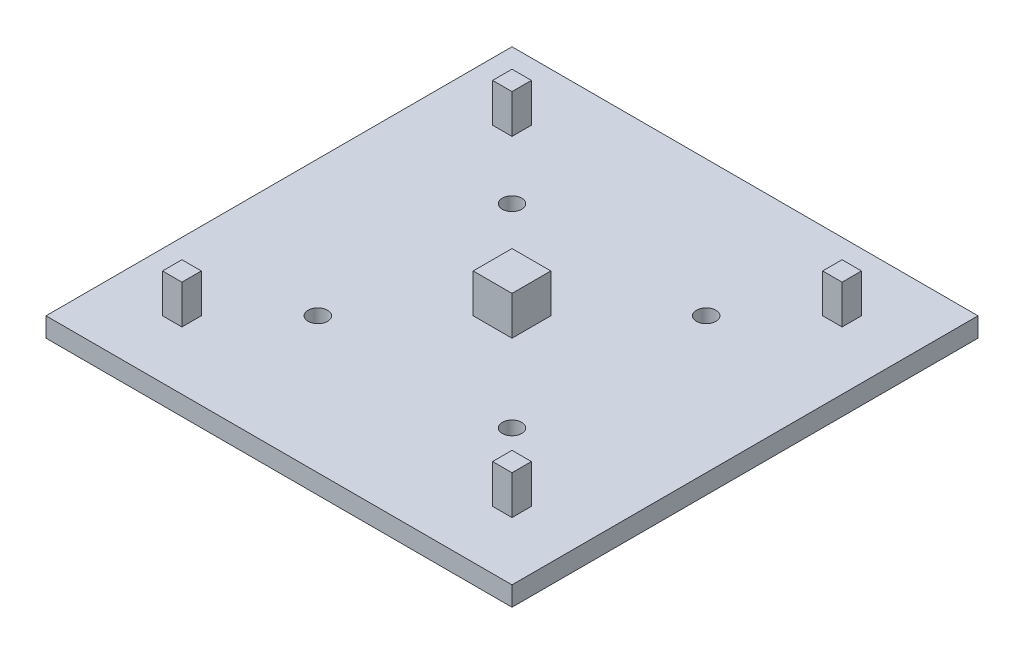
from build123d import *

# Parameters (mm, degrees)
SKETCH1_W           = 120
SKETCH1_H           = 120
BOSS_EXTRUDE1_DEPTH = 5
SKETCH2_R           = 2.5
CUT_EXTRUDE1_DEPTH  = 5
SKETCH3_R           = 2.5
CUT_EXTRUDE2_DEPTH  = 5
SKETCH4_R           = 2.5
CUT_EXTRUDE3_DEPTH  = 5
SKETCH5_R           = 2.5
CUT_EXTRUDE4_DEPTH  = 5
SKETCH6_W           = 10
SKETCH6_H           = 10
BOSS_EXTRUDE2_DEPTH = 10
SKETCH10_W          = 5
SKETCH10_H          = 5
BOSS_EXTRUDE4_DEPTH = 10
SKETCH11_W          = 5
SKETCH11_H          = 5
BOSS_EXTRUDE5_DEPTH = 10
SKETCH12_W          = 5
SKETCH12_H          = 5
BOSS_EXTRUDE6_DEPTH = 10
SKETCH13_W          = 5
SKETCH13_H          = 5
BOSS_EXTRUDE7_DEPTH = 10


with BuildPart() as part:
    # Sketch1 → Boss-Extrude1 (new body)
    with BuildSketch(Plane(origin=(0, 0, 0), x_dir=(1, 0, 0), z_dir=(0, 1, 0))):
        Rectangle(SKETCH1_W, SKETCH1_H)
    extrude(amount=BOSS_EXTRUDE1_DEPTH)

    # Sketch2 → Cut-Extrude1 (cut)
    with BuildSketch(Plane(origin=(0, 5, 0), x_dir=(1, 0, 0), z_dir=(0, 1, 0))):
        with Locations(Location((-25, 25, 0), (0, 0, 270))):
            Circle(SKETCH2_R)
    extrude(amount=-CUT_EXTRUDE1_DEPTH, mode=Mode.SUBTRACT)

    # Sketch3 → Cut-Extrude2 (cut)
    with BuildSketch(Plane(origin=(0, 5, 0), x_dir=(1, 0, 0), z_dir=(0, 1, 0))):
        with Locations(Location((25, 25, 0), (0, 0, 270))):
            Circle(SKETCH3_R)
    extrude(amount=-CUT_EXTRUDE2_DEPTH, mode=Mode.SUBTRACT)

    # Sketch4 → Cut-Extrude3 (cut)
    with BuildSketch(Plane(origin=(0, 5, 0), x_dir=(1, 0, 0), z_dir=(0, 1, 0))):
        with Locations(Location((25, -25, 0), (0, 0, 270))):
            Circle(SKETCH4_R)
    extrude(amount=-CUT_EXTRUDE3_DEPTH, mode=Mode.SUBTRACT)

    # Sketch5 → Cut-Extrude4 (cut)
    with BuildSketch(Plane(origin=(0, 5, 0), x_dir=(1, 0, 0), z_dir=(0, 1, 0))):
        with Locations(Location((-25, -25, 0), (0, 0, 270))):
            Circle(SKETCH5_R)
    extrude(amount=-CUT_EXTRUDE4_DEPTH, mode=Mode.SUBTRACT)

    # Sketch6 → Boss-Extrude2 (add)
    with BuildSketch(Plane(origin=(0, 5, 0), x_dir=(1, 0, 0), z_dir=(0, 1, 0))):
        Rectangle(SKETCH6_W, SKETCH6_H)
    extrude(amount=BOSS_EXTRUDE2_DEPTH)

    # Sketch10 → Boss-Extrude4 (add)
    with BuildSketch(Plane(origin=(0, 5, 0), x_dir=(1, 0, 0), z_dir=(0, 1, 0))):
        with Locations((42.5, 42.5)):
            Rectangle(SKETCH10_W, SKETCH10_H)
    extrude(amount=BOSS_EXTRUDE4_DEPTH)

    # Sketch11 → Boss-Extrude5 (add)
    with BuildSketch(Plane(origin=(0, 5, 0), x_dir=(1, 0, 0), z_dir=(0, 1, 0))):
        with Locations((-42.5, 42.5)):
            Rectangle(SKETCH11_W, SKETCH11_H)
    extrude(amount=BOSS_EXTRUDE5_DEPTH)

    # Sketch12 → Boss-Extrude6 (add)
    with BuildSketch(Plane(origin=(0, 5, 0), x_dir=(1, 0, 0), z_dir=(0, 1, 0))):
        with Locations((42.5, -42.5)):
            Rectangle(SKETCH12_W, SKETCH12_H)
    extrude(amount=BOSS_EXTRUDE6_DEPTH)

    # Sketch13 → Boss-Extrude7 (add)
    with BuildSketch(Plane(origin=(0, 5, 0), x_dir=(1, 0, 0), z_dir=(0, 1, 0))):
        with Locations((-42.5, -42.5)):
            Rectangle(SKETCH13_W, SKETCH13_H)
    extrude(amount=BOSS_EXTRUDE7_DEPTH)


solid = part.part
